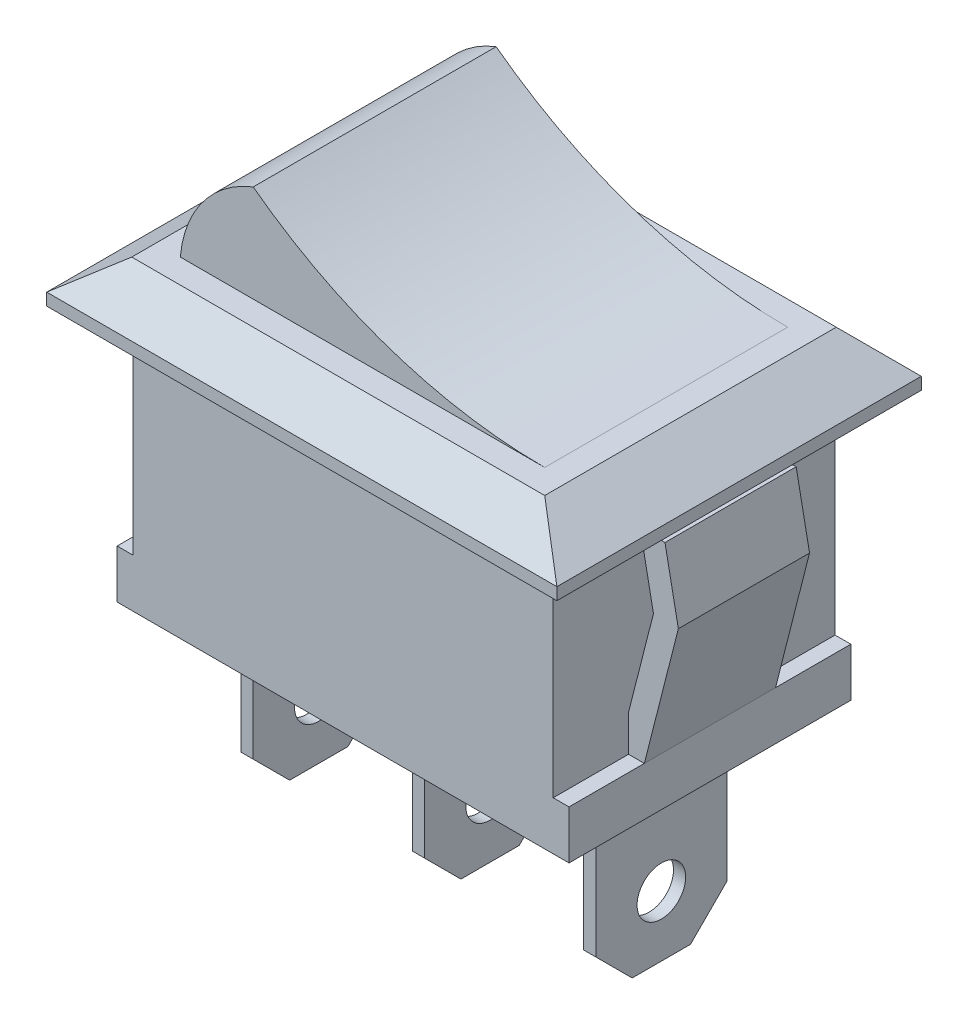
from build123d import *

# Parameters (mm, degrees)
EXTRUDE_1_DEPTH             = 5.8
EXTRUDE_1_DEPTH_BACK        = 5.8
SKETCH_1_W                  = 17.3
SKETCH_1_H                  = 10.8
EXTRUDE_2_DEPTH             = 7.5
EXTRUDE_2_DEPTH_BACK        = 7.5
CHAMFER_1_SIZE              = 1.5
EXTRUDE_3_DEPTH             = 5
EXTRUDE_3_DEPTH_BACK        = 5
EXTRUDE_4_REACH             = 23.183
SKETCH_4_W                  = 18.6
SKETCH_4_H                  = 2
EXTRUDE_4_DIRECTION_2_REACH = 23.183
EXTRUDE_5_DEPTH             = 2.7
EXTRUDE_5_DEPTH_BACK        = 2.7
SKETCH_5_W                  = 0.5
SKETCH_5_H                  = 7.4
SKETCH_6_R                  = 1
SKETCH_6_R_2                = 0.75
CUT_EXTRUDE_1_DEPTH         = 26.738881095


with BuildPart() as part:
    # 草图1 → 凸台-拉伸1 (new, two sides: drawn at the far end of the back side and taken through both)
    with BuildSketch(Plane.XY.offset(-EXTRUDE_1_DEPTH_BACK)):
        with Locations((0, 5.4)):
            Rectangle(SKETCH_1_W, SKETCH_1_H)
    extrude(amount=EXTRUDE_1_DEPTH + EXTRUDE_1_DEPTH_BACK)

    # 草图2 → 凸台-拉伸2 (add, two sides: drawn at the far end of the back side and taken through both)
    with BuildSketch(Plane.XY.offset(-EXTRUDE_2_DEPTH_BACK)):
        Polygon((-8.5, 12.8), (-10.5, 11.3), (-10.5, 10.8), (10.5, 10.8), (10.5, 11.3), (8.5, 12.8), align=None)
    extrude(amount=EXTRUDE_2_DEPTH + EXTRUDE_2_DEPTH_BACK)

    # 倒角1
    chamfer_1_edges = [part.edges().sort_by_distance(p)[0] for p in [
        (0, 12.8, -7.5),
        (0, 12.8, 7.5),
    ]]
    chamfer(chamfer_1_edges, length=CHAMFER_1_SIZE)

    # 草图3 → 凸台-拉伸3 (add, two sides: drawn at the far end of the back side and taken through both)
    with BuildSketch(Plane.XY.offset(-EXTRUDE_3_DEPTH_BACK)):
        with BuildLine():
            ThreePointArc((-4.5, 16.8), (-6.57373706, 15.230302795), (-7.5, 12.8))
            Line((-7.5, 12.8), (7.5, 12.8))
            ThreePointArc((7.5, 12.8), (1.17544468, 13.826334039), (-4.5, 16.8))
        make_face()
    extrude(amount=EXTRUDE_3_DEPTH + EXTRUDE_3_DEPTH_BACK)

    # 凸台-拉伸4: up to this face of the body (flat: up to its plane)
    extrude_4_end = Plane(part.part.faces().sort_by_distance((0, 5.4, 5.8))[0])
    # 草图4 → 凸台-拉伸4 (add, up to the picked face)
    with BuildSketch(Plane.XY, mode=Mode.PRIVATE) as extrude_4_sk1:
        with Locations((0, 1)):
            Rectangle(SKETCH_4_W, SKETCH_4_H)
    extrude_4_tool1 = split(extrude(extrude_4_sk1.sketch, amount=EXTRUDE_4_REACH, mode=Mode.PRIVATE), bisect_by=extrude_4_end, keep=Keep.BOTH, mode=Mode.PRIVATE)
    add(extrude_4_tool1.solids().sort_by(Axis((0, 1, 0), (0, 0, 1)))[0])

    # 凸台-拉伸4 direction 2: up to this face of the body (flat: up to its plane)
    extrude_4_direction_2_end = Plane(part.part.faces().sort_by_distance((0, 5.4, -5.8))[0])
    # 草图4 → 凸台-拉伸4 direction 2 (add, up to the picked face)
    with BuildSketch(Plane.XY, mode=Mode.PRIVATE) as extrude_4_direction_2_sk1:
        with Locations((0, 1)):
            Rectangle(SKETCH_4_W, SKETCH_4_H)
    extrude_4_direction_2_tool1 = split(extrude(extrude_4_direction_2_sk1.sketch, amount=-EXTRUDE_4_DIRECTION_2_REACH, mode=Mode.PRIVATE), bisect_by=extrude_4_direction_2_end, keep=Keep.BOTH, mode=Mode.PRIVATE)
    add(extrude_4_direction_2_tool1.solids().sort_by(Axis((0, 1, 0), (0, 0, -1)))[0])

    # 草图5 → 凸台-拉伸5 (add, two sides: drawn at the far end of the back side and taken through both)
    with BuildSketch(Plane.XY.offset(-EXTRUDE_5_DEPTH_BACK)):
        Polygon((-9.3, 2), (-10.7, 7.5), (-10.15, 10.3), (-9.130890495, 10.3), (-9.168751179, 10.107254696), (-9.675324513, 7.528335908), (-8.65, 3.500275321), (-8.65, 2), align=None)
        Polygon((8.65, 2), (8.65, 3.500275321), (9.675324513, 7.528335908), (9.168751179, 10.107254696), (9.130890495, 10.3), (10.15, 10.3), (10.7, 7.5), (9.3, 2), align=None)
        with Locations((0, -3.7)):
            Rectangle(SKETCH_5_W, SKETCH_5_H)
        with Locations((-7.05, -3.7)):
            Rectangle(SKETCH_5_W, SKETCH_5_H)
        with Locations((7.05, -3.7)):
            Rectangle(SKETCH_5_W, SKETCH_5_H)
    extrude(amount=EXTRUDE_5_DEPTH + EXTRUDE_5_DEPTH_BACK)

    # 草图6 → 切除-拉伸1 (cut, through all)
    with BuildSketch(Plane.ZY.offset(7.3)):
        Polygon((2.7, -5.9), (1.2, -7.4), (2.7, -7.4), align=None)
        Polygon((-1.2, -7.4), (-2.7, -5.9), (-2.7, -7.4), align=None)
        with Locations((0, -4.9)):
            Circle(SKETCH_6_R)
        with Locations((0, -0.9)):
            Circle(SKETCH_6_R_2)
    extrude(amount=-CUT_EXTRUDE_1_DEPTH, mode=Mode.SUBTRACT)


solid = part.part
